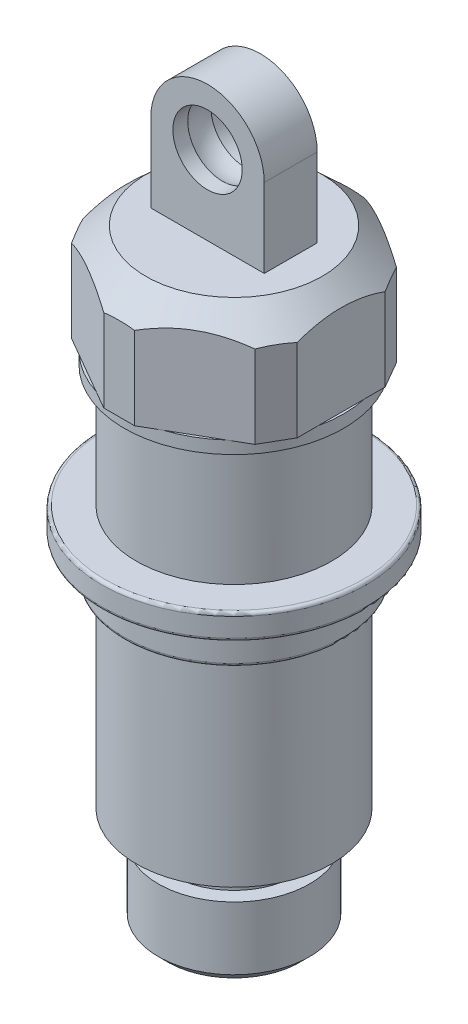
from build123d import *

# Parameters (mm, degrees)
BOSS_EXTRUDE1_DEPTH  = 8.6
CHAMFER1_SIZE        = 1.414
CHAMFER1_EDGE_2_SIZE = 1.414
CHAMFER1_EDGE_3_SIZE = 1.414
CHAMFER1_EDGE_4_SIZE = 1.414
CHAMFER1_EDGE_5_SIZE = 1.414
CHAMFER1_EDGE_6_SIZE = 1.414
FILLET2_R            = 0.25
SKETCH6_R            = 1.5
CUT_EXTRUDE1_DEPTH   = 28
BOSS_EXTRUDE2_DEPTH  = 2.1
SKETCH9_R            = 2.75
CUT_EXTRUDE2_DEPTH   = 4.2
CHAMFER3_SIZE        = 0.75


with BuildPart() as part:
    # Sketch1 → Revolve1 (revolve)
    with BuildSketch(Plane.XY, mode=Mode.PRIVATE) as revolve1_sk:
        Polygon((0, 0), (6, 0), (6, 5.75), (4.875, 5.75), (4.875, 6.5), (7.75, 8), (7.75, 38.4), (8.7, 38.4), (8.7, 39.4), (0, 39.4), align=None)
    revolve(revolve1_sk.sketch.rotate(Axis((0, 39.4, 0), (0, -1, 0)), 180), axis=Axis((0, 39.4, 0), (0, -1, 0)))

    # Sketch3 → Boss-Extrude1 (add)
    with BuildSketch(Plane(origin=(0, 39.4, 0), x_dir=(1, 0, 0), z_dir=(0, 1, 0))):
        Polygon((0, 9.814954576), (-8.5, 4.907477288), (-8.5, -4.907477288), (0, -9.814954576), (8.5, -4.907477288), (8.5, 4.907477288), align=None)
    extrude(amount=BOSS_EXTRUDE1_DEPTH)

    # Chamfer1
    chamfer1_edges = [part.edges().sort_by_distance(p)[0] for p in [
        (8.5, 43.7, -4.907477288),
    ]]
    chamfer(chamfer1_edges, length=CHAMFER1_SIZE)

    # Chamfer1 edge 2
    chamfer1_edge_2_edges = [part.edges().sort_by_distance(p)[0] for p in [
        (0, 43.7, -9.814954576),
    ]]
    chamfer(chamfer1_edge_2_edges, length=CHAMFER1_EDGE_2_SIZE)

    # Chamfer1 edge 3
    chamfer1_edge_3_edges = [part.edges().sort_by_distance(p)[0] for p in [
        (-8.5, 43.7, -4.907477288),
    ]]
    chamfer(chamfer1_edge_3_edges, length=CHAMFER1_EDGE_3_SIZE)

    # Chamfer1 edge 4
    chamfer1_edge_4_edges = [part.edges().sort_by_distance(p)[0] for p in [
        (-8.5, 43.7, 4.907477288),
    ]]
    chamfer(chamfer1_edge_4_edges, length=CHAMFER1_EDGE_4_SIZE)

    # Chamfer1 edge 5
    chamfer1_edge_5_edges = [part.edges().sort_by_distance(p)[0] for p in [
        (0, 43.7, 9.814954576),
    ]]
    chamfer(chamfer1_edge_5_edges, length=CHAMFER1_EDGE_5_SIZE)

    # Chamfer1 edge 6
    chamfer1_edge_6_edges = [part.edges().sort_by_distance(p)[0] for p in [
        (8.5, 43.7, 4.907477288),
    ]]
    chamfer(chamfer1_edge_6_edges, length=CHAMFER1_EDGE_6_SIZE)

    # Sketch5 → Revolve2 (revolve)
    with BuildSketch(Plane.XY, mode=Mode.PRIVATE) as revolve2_sk:
        Polygon((7.75, 28.801965379), (10.5, 28.801965379), (10.5, 26.801965379), (8.7, 26.801965379), (8.7, 23.801965379), (7.75, 23.801965379), align=None)
    revolve(revolve2_sk.sketch.rotate(Axis((0, 0, 0), (0, 1, 0)), 180), axis=Axis((0, 0, 0), (0, 1, 0)))

    # Fillet2
    fillet2_edges = [part.edges().sort_by_distance(p)[0] for p in [
        (10.5, 28.801965379, 0),
        (10.5, 26.801965379, 0),
        (8.7, 23.801965379, 0),
    ]]
    fillet(fillet2_edges, radius=FILLET2_R)

    # Sketch6 → Cut-Extrude1 (cut)
    with BuildSketch(Plane.XZ):
        Circle(SKETCH6_R)
    extrude(amount=-CUT_EXTRUDE1_DEPTH, mode=Mode.SUBTRACT)

    # Sketch7 → Boss-Extrude2 (add, symmetric)
    with BuildSketch(Plane.XY):
        with BuildLine():
            Line((4.5, 54.25), (4.5, 48))
            Line((4.5, 48), (-4.5, 48))
            Line((-4.5, 48), (-4.5, 54.25))
            ThreePointArc((-4.5, 54.25), (0, 58.75), (4.5, 54.25))
        make_face()
    extrude(amount=BOSS_EXTRUDE2_DEPTH, both=True)

    # Sketch8 → Cut-Revolve1 (revolve, cut)
    with BuildSketch(Plane.XY):
        with BuildLine():
            Line((0, 57.15), (0, 51.35))
            ThreePointArc((0, 51.35), (2.9, 54.25), (0, 57.15))
        make_face()
    revolve(axis=Axis((0, 48, 0), (0, 1, 0)), mode=Mode.SUBTRACT)

    # Sketch10 → Cut-Revolve2 (revolve, cut)
    with BuildSketch(Plane.XY, mode=Mode.PRIVATE) as cut_revolve2_sk:
        Polygon((7, 48), (8.5, 46.6), (10.124681139, 45.083630937), (10.124681139, 47.819402207), (7, 50.73577127), align=None)
    revolve(cut_revolve2_sk.sketch.rotate(Axis((0, 0, 0), (0, 1, 0)), 90), axis=Axis((0, 0, 0), (0, 1, 0)), mode=Mode.SUBTRACT)

    # Sketch9 → Cut-Extrude2 (cut)
    with BuildSketch(Plane.XY.offset(2.1)):
        with Locations((0, 54.25)):
            Circle(SKETCH9_R)
    extrude(amount=-CUT_EXTRUDE2_DEPTH, mode=Mode.SUBTRACT)

    # Chamfer3
    chamfer3_edges = [part.edges().sort_by_distance(p)[0] for p in [
        (6, 0, 0),
    ]]
    chamfer(chamfer3_edges, length=CHAMFER3_SIZE)


solid = part.part
